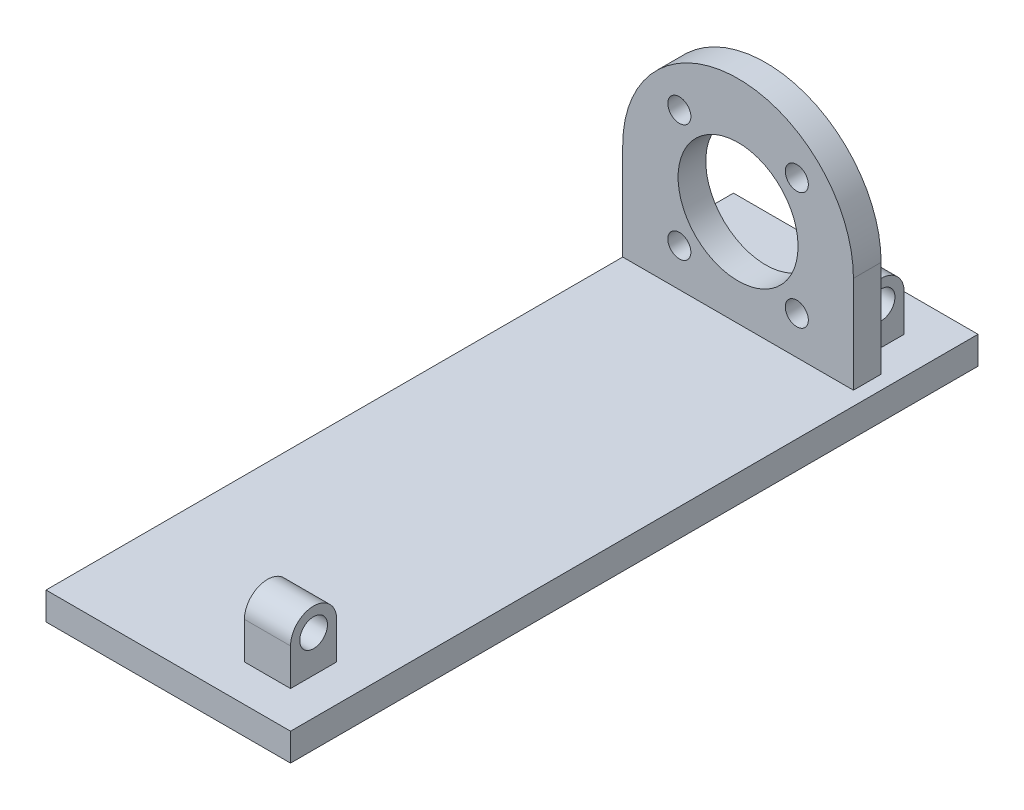
from build123d import *

# Parameters (mm, degrees)
CROQUIS1_R              = 13
SALIENTE_EXTRUIR1_DEPTH = 3
CROQUIS2_W              = 50
CROQUIS2_H              = 6
SALIENTE_EXTRUIR2_DEPTH = 9
CROQUIS3_W              = 50
CROQUIS3_H              = 6
SALIENTE_EXTRUIR3_DEPTH = 107
CROQUIS4_W              = 50
CROQUIS4_H              = 6
SALIENTE_EXTRUIR4_DEPTH = 6
CROQUIS5_R              = 2.5
CORTAR_EXTRUIR1_DEPTH   = 116.021737076
CROQUIS6_W              = 50
CROQUIS6_H              = 6
SALIENTE_EXTRUIR5_DEPTH = 18
CROQUIS7_W              = 50
CROQUIS7_H              = 6
SALIENTE_EXTRUIR6_DEPTH = 18
CROQUIS8_R              = 3
SALIENTE_EXTRUIR7_DEPTH = 10
SALIENTE_EXTRUIR8_DEPTH = 3


with BuildPart() as part:
    # Croquis1 → Saliente-Extruir1 (new, symmetric)
    with BuildSketch(Plane.XY):
        with BuildLine():
            Line((25, -9), (-25, -9))
            Line((-25, -9), (-25, 9))
            ThreePointArc((-25, 9), (0, 34), (25, 9))
            Line((25, 9), (25, -9))
        make_face()
        with Locations((0, 9)):
            Circle(CROQUIS1_R, mode=Mode.SUBTRACT)
    extrude(amount=SALIENTE_EXTRUIR1_DEPTH, both=True)

    # Croquis2 → Saliente-Extruir2 (add)
    with BuildSketch(Plane.XZ.offset(9)):
        Rectangle(CROQUIS2_W, CROQUIS2_H)
    extrude(amount=SALIENTE_EXTRUIR2_DEPTH)



with BuildPart() as body_2:
    # Croquis3 → Saliente-Extruir3 (new body)
    with BuildSketch(Plane.XY.offset(3)):
        with Locations((0, -15)):
            Rectangle(CROQUIS3_W, CROQUIS3_H)
    extrude(amount=SALIENTE_EXTRUIR3_DEPTH)


with BuildPart() as part_1:
    add(part.part)

    add(body_2.part)  # Saliente-Extruir4 merges body 2
    # Croquis4 → Saliente-Extruir4 (add)
    with BuildSketch(Plane(origin=(0, 0, 3), x_dir=(-1, 0, 0), z_dir=(0, 0, -1))):
        with Locations((0, -15)):
            Rectangle(CROQUIS4_W, CROQUIS4_H)
    extrude(amount=SALIENTE_EXTRUIR4_DEPTH)

    # Croquis5 → Cortar-Extruir1 (cut, through all)
    with BuildSketch(Plane.XY.offset(3)):
        with Locations((12.727922061, 21.727922061)):
            Circle(CROQUIS5_R)
        with Locations((12.727922061, -3.727922061)):
            Circle(CROQUIS5_R)
        with Locations((-12.727922061, -3.727922061)):
            Circle(CROQUIS5_R)
        with Locations((-12.727922061, 21.727922061)):
            Circle(CROQUIS5_R)
    extrude(amount=-CORTAR_EXTRUIR1_DEPTH, mode=Mode.SUBTRACT)

    # Croquis6 → Saliente-Extruir5 (add)
    with BuildSketch(Plane.XY.offset(110)):
        with Locations((0, -15)):
            Rectangle(CROQUIS6_W, CROQUIS6_H)
    extrude(amount=SALIENTE_EXTRUIR5_DEPTH)

    # Croquis7 → Saliente-Extruir6 (add)
    with BuildSketch(Plane(origin=(0, 0, -3), x_dir=(-1, 0, 0), z_dir=(0, 0, -1))):
        with Locations((0, -15)):
            Rectangle(CROQUIS7_W, CROQUIS7_H)
    extrude(amount=SALIENTE_EXTRUIR6_DEPTH)

    # Croquis8 → Saliente-Extruir7 (add)
    with BuildSketch(Plane(origin=(20, 0, 0), x_dir=(0, 0, -1), z_dir=(1, 0, 0))):
        with BuildLine():
            Line((3, -4), (3, -12))
            Line((3, -12), (13, -12))
            Line((13, -12), (13, -4))
            ThreePointArc((13, -4), (8, 1), (3, -4))
        make_face()
        with Locations((8, -4)):
            Circle(CROQUIS8_R, mode=Mode.SUBTRACT)
    saliente_extruir7 = extrude(amount=-SALIENTE_EXTRUIR7_DEPTH)

    # Simetría1: Saliente-Extruir7 across plane
    add(saliente_extruir7.mirror(Plane(origin=(0, 0, 53.5), x_dir=(1, 0, 0), z_dir=(0, 0, -1))))

    # Croquis9 → Saliente-Extruir8 (add)
    with BuildSketch(Plane(origin=(25, 0, 0), x_dir=(0, 0, -1), z_dir=(1, 0, 0))):
        Polygon((-128, -18), (21, -18), (21, -12), (3, -12), (-128, -12), align=None)
    extrude(amount=SALIENTE_EXTRUIR8_DEPTH)


solid = part_1.part
